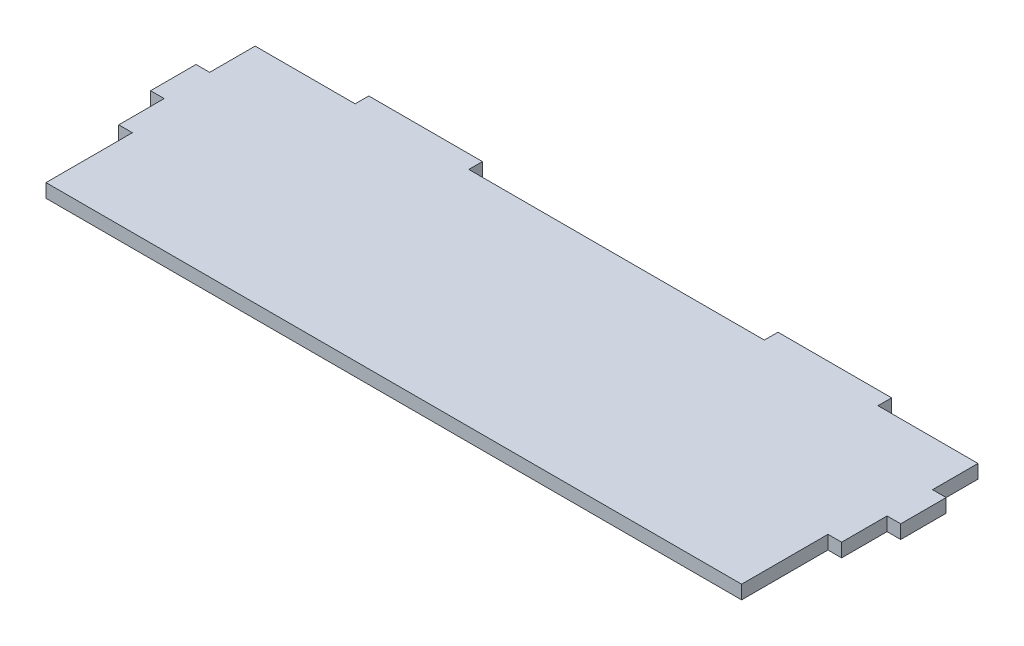
from build123d import *

# Parameters (mm, degrees)
BOSS_EXTRUDE1_DEPTH = 3


with BuildPart() as part:
    # Sketch2 → Boss-Extrude1 (new body)
    with BuildSketch(Plane(origin=(0, 0, 0), x_dir=(1, 0, 0), z_dir=(0, 1, 0))):
        Polygon((-79.5, 14.971153846), (-79.5, 24.971153846), (-57.5, 24.971153846), (-57.5, 27.971153846), (-32.5, 27.971153846), (-32.5, 24.971153846), (32.5, 24.971153846), (32.5, 27.971153846), (57.5, 27.971153846), (57.5, 24.971153846), (79.5, 24.971153846), (79.5, 14.971153846), (82.5, 14.971153846), (82.5, 4.971153846), (79.5, 4.971153846), (79.5, -5.028846154), (76.5, -5.028846154), (76.5, -24.028846154), (-76.5, -24.028846154), (-76.5, -5.028846154), (-79.5, -5.028846154), (-79.5, 4.971153846), (-82.5, 4.971153846), (-82.5, 14.971153846), align=None)
    extrude(amount=BOSS_EXTRUDE1_DEPTH)


solid = part.part
